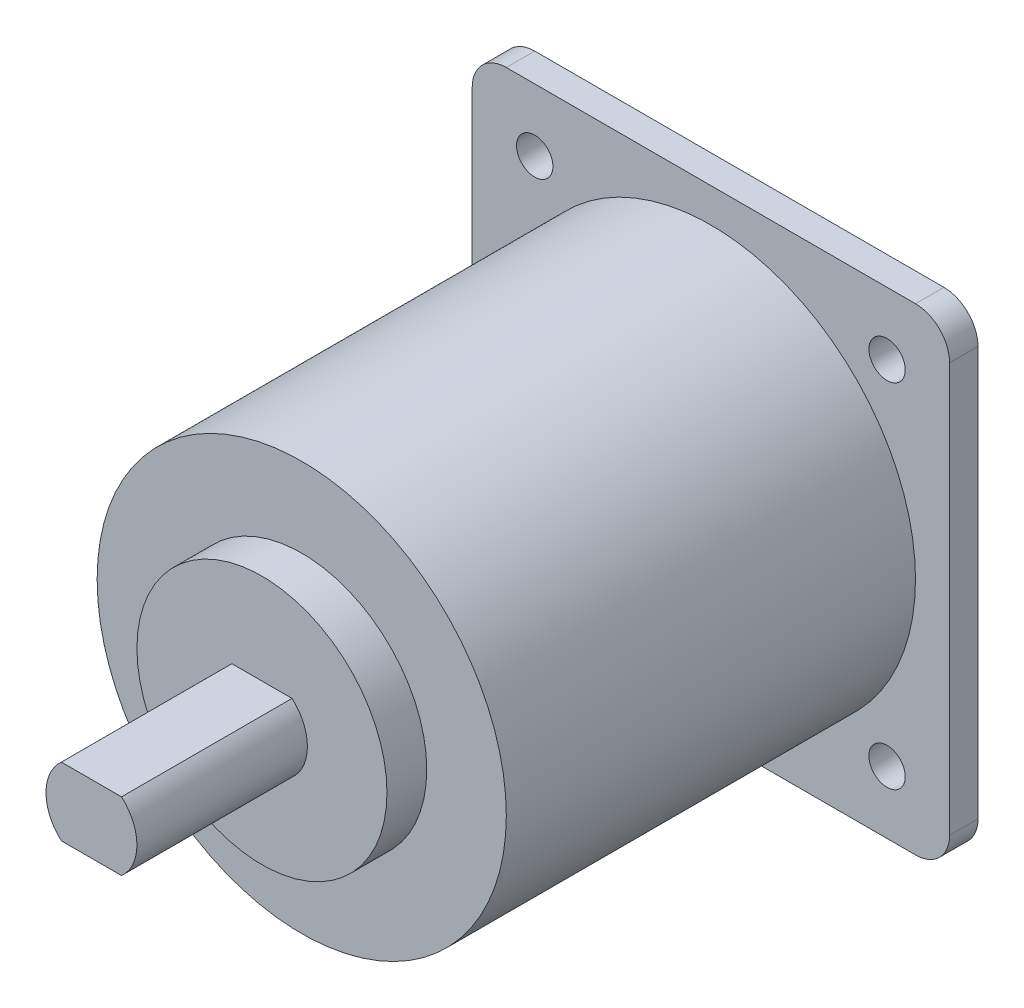
from build123d import *

# Parameters (mm, degrees)
SKETCH_1_R          = 18
EXTRUDE_1_DEPTH     = 38.5
SKETCH_1_3_W        = 42
SKETCH_1_3_H        = 42
SKETCH_1_3_R        = 18
EXTRUDE_2_DEPTH     = 2.5
FILLET_1_R          = 3
SKETCH_4_R          = 1.6
CUT_EXTRUDE_1_DEPTH = 2.5
SKETCH_5_R          = 11
EXTRUDE_3_DEPTH     = 3.5
EXTRUDE_4_DEPTH     = 15
SKETCH_7_R          = 11
CUT_EXTRUDE_2_DEPTH = 25


with BuildPart() as part:
    # 草图1 → 凸台-拉伸1 (new body)
    with BuildSketch(Plane.XY):
        Circle(SKETCH_1_R)
    extrude(amount=EXTRUDE_1_DEPTH)

    # 草图1<3> → 凸台-拉伸2 (add)
    with BuildSketch(Plane.XY):
        Rectangle(SKETCH_1_3_W, SKETCH_1_3_H)
        Circle(SKETCH_1_3_R, mode=Mode.SUBTRACT)
    extrude(amount=EXTRUDE_2_DEPTH)

    # 圆角1
    fillet_1_edges = [part.edges().sort_by_distance(p)[0] for p in [
        (21, -21, 1.25),
        (-21, -21, 1.25),
        (-21, 21, 1.25),
        (21, 21, 1.25),
    ]]
    fillet(fillet_1_edges, radius=FILLET_1_R)

    # 草图4 → 切除-拉伸1 (cut)
    with BuildSketch(Plane(origin=(0, 0, 0), x_dir=(-1, 0, 0), z_dir=(0, 0, -1))):
        with Locations((-15.5, 15.5)):
            Circle(SKETCH_4_R)
        with Locations((-15.5, -15.5)):
            Circle(SKETCH_4_R)
        with Locations((15.5, -15.5)):
            Circle(SKETCH_4_R)
        with Locations((15.5, 15.5)):
            Circle(SKETCH_4_R)
    extrude(amount=-CUT_EXTRUDE_1_DEPTH, mode=Mode.SUBTRACT)

    # 草图5 → 凸台-拉伸3 (add)
    with BuildSketch(Plane.XY.offset(38.5)):
        Circle(SKETCH_5_R)
    extrude(amount=EXTRUDE_3_DEPTH)

    # 草图6 → 凸台-拉伸4 (add)
    with BuildSketch(Plane.XY.offset(42)):
        with BuildLine():
            Line((-2.645751311, -3), (2.645751311, -3))
            ThreePointArc((2.645751311, -3), (4, 0), (2.645751311, 3))
            Line((2.645751311, 3), (-2.645751311, 3))
            ThreePointArc((-2.645751311, 3), (-4, 0), (-2.645751311, -3))
        make_face()
    extrude(amount=EXTRUDE_4_DEPTH)

    # 草图7 → 切除-拉伸2 (cut)
    with BuildSketch(Plane(origin=(0, 0, 0), x_dir=(-1, 0, 0), z_dir=(0, 0, -1))):
        Circle(SKETCH_7_R)
    extrude(amount=-CUT_EXTRUDE_2_DEPTH, mode=Mode.SUBTRACT)


solid = part.part
